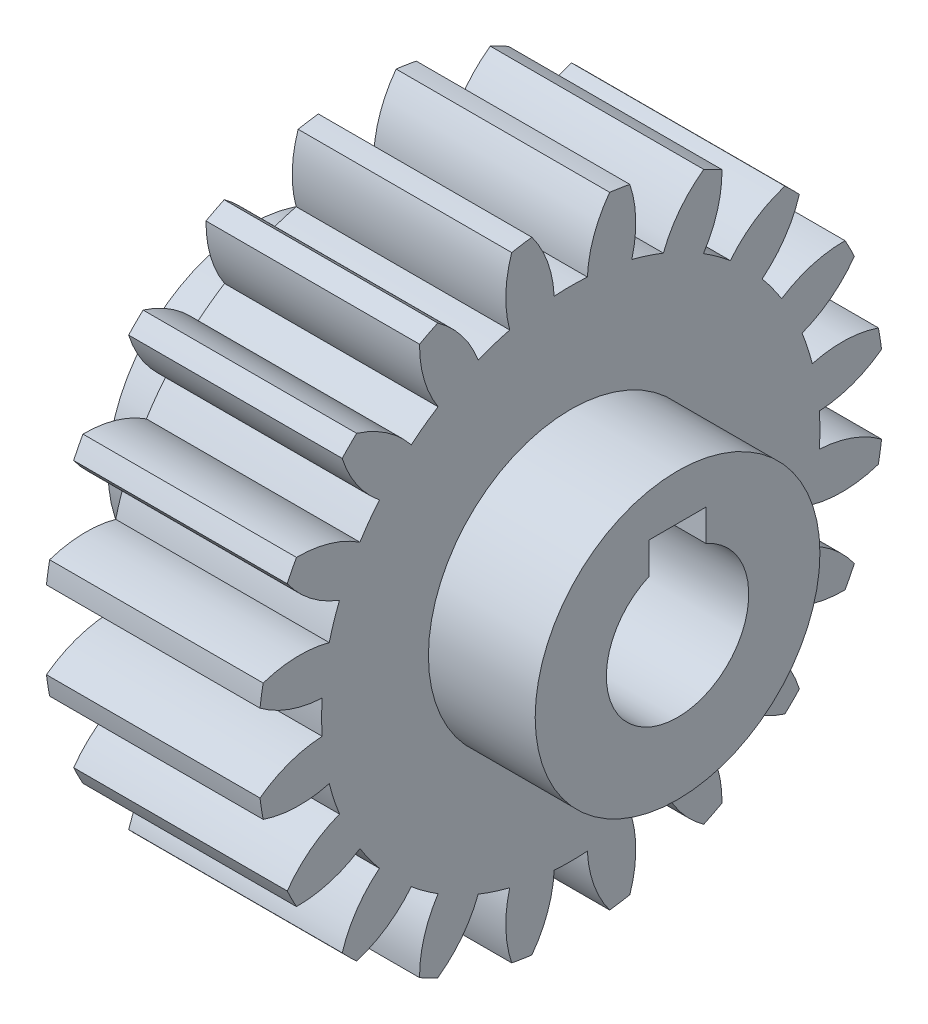
from build123d import *

# Parameters (mm, degrees)
BASPROSKE_W       = 15
BASPROSKE_H       = 22
TOOTHCUT_DEPTH    = 35.539832078
TEETHCUTS_COUNT   = 20
TEETHCUTS_ANGLE   = 342
HUBNEABOTSKE_R    = 10
HUBNEARBOTH_DEPTH = 7.5000254
HUBFAR_START      = 7.5000254
HUBFARSKE_R       = 10
HUBFAR_DEPTH      = 7.5000254
BORSKE_R          = 5
BORE_DEPTH        = 30.0000508
KEYSKE_W          = 4
KEYSKE_H          = 6.8
KEYWAY_DEPTH      = 30.0000508


with BuildPart() as part:
    # BasProSke → Base-Revolve (revolve)
    with BuildSketch(Plane(origin=(0, 0, 0), x_dir=(1, 0, 0), z_dir=(0, 1, 0)), mode=Mode.PRIVATE) as base_revolve_sk:
        with Locations((7.5, 11)):
            Rectangle(BASPROSKE_W, BASPROSKE_H)
    revolve(base_revolve_sk.sketch.rotate(Axis((-10, 0, 0), (1, 0, 0)), 180), axis=Axis((-10, 0, 0), (1, 0, 0)))

    # TooCutSke → ToothCut (cut, through all)
    with BuildSketch(Plane(origin=(0, 0, 0), x_dir=(0, 0, -1), z_dir=(1, 0, 0))):
        with BuildLine():
            ThreePointArc((1.164972225, 17.460178714), (0, 17.499), (-1.164972225, 17.460178714))
            ThreePointArc((-1.164972225, 17.460178714), (-1.629088534, 19.774822006), (-2.748549048, 21.853231415))
            ThreePointArc((-2.748549048, 21.853231415), (0, 22.0254), (2.748549048, 21.853231415))
            ThreePointArc((2.748549048, 21.853231415), (1.629088534, 19.774822006), (1.164972225, 17.460178714))
        make_face()
    toothcut = extrude(amount=TOOTHCUT_DEPTH, mode=Mode.SUBTRACT)

    # TeethCuts: ToothCut ×20 about axis
    teethcuts_axis = Axis((-10, 0, 0), (1, 0, 0))
    for i in range(1, TEETHCUTS_COUNT):
        add(toothcut.rotate(teethcuts_axis, i * TEETHCUTS_ANGLE / (TEETHCUTS_COUNT - 1)), mode=Mode.SUBTRACT)

    # HubNeaBotSke → HubNearBoth (add)
    with BuildSketch(Plane.ZY):
        with Locations(Location((0, 0, 0), (0, 0, 180))):
            Circle(HUBNEABOTSKE_R)
    extrude(amount=HUBNEARBOTH_DEPTH)

    # HubFarSke → HubFar (add)
    with BuildSketch(Plane(origin=(15, 0, 0), x_dir=(0, 0, -1), z_dir=(1, 0, 0)).offset(HUBFAR_START)):
        Circle(HUBFARSKE_R)
    extrude(amount=-HUBFAR_DEPTH)

    # BorSke → Bore (cut, symmetric)
    with BuildSketch(Plane(origin=(0, 0, 0), x_dir=(0, 0, -1), z_dir=(1, 0, 0))):
        with Locations(Location((0, 0, 0), (0, 0, 180))):
            Circle(BORSKE_R)
    extrude(amount=BORE_DEPTH, both=True, mode=Mode.SUBTRACT)

    # KeySke → Keyway (cut, symmetric)
    with BuildSketch(Plane(origin=(0, 0, 0), x_dir=(0, 0, -1), z_dir=(1, 0, 0))):
        with Locations((0, 3.4)):
            Rectangle(KEYSKE_W, KEYSKE_H)
    extrude(amount=KEYWAY_DEPTH, both=True, mode=Mode.SUBTRACT)


solid = part.part
